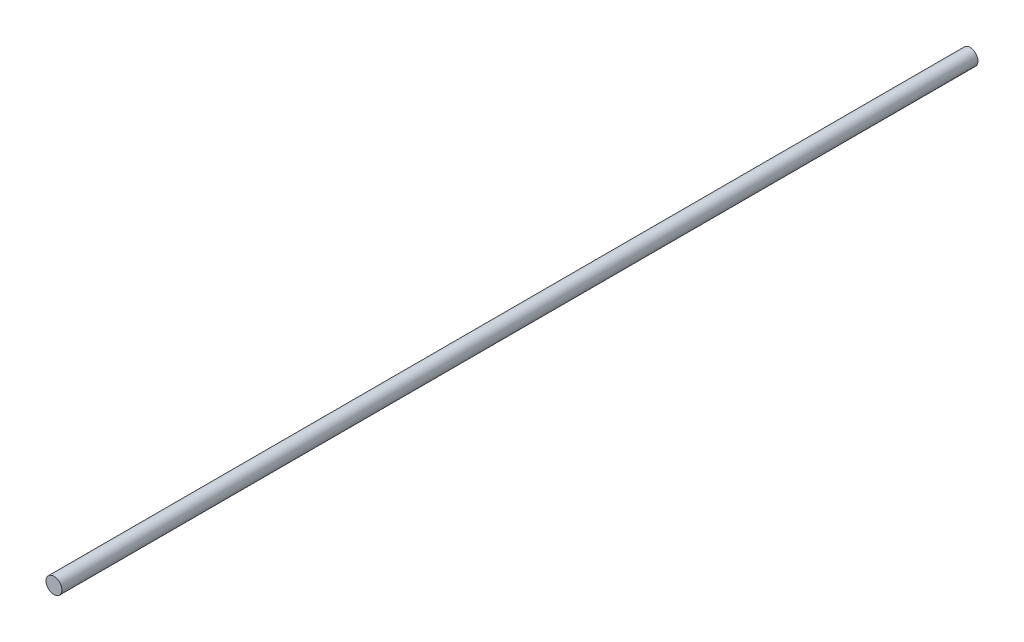
from build123d import *

# Parameters (mm, degrees)
SCHIZZO1_R                   = 1.5
ESTRUSIONE_ESTRUSIONE1_DEPTH = 173


with BuildPart() as part:
    # Schizzo1 → Estrusione-Estrusione1 (new body)
    with BuildSketch(Plane.XY):
        Circle(SCHIZZO1_R)
    extrude(amount=ESTRUSIONE_ESTRUSIONE1_DEPTH)


solid = part.part
